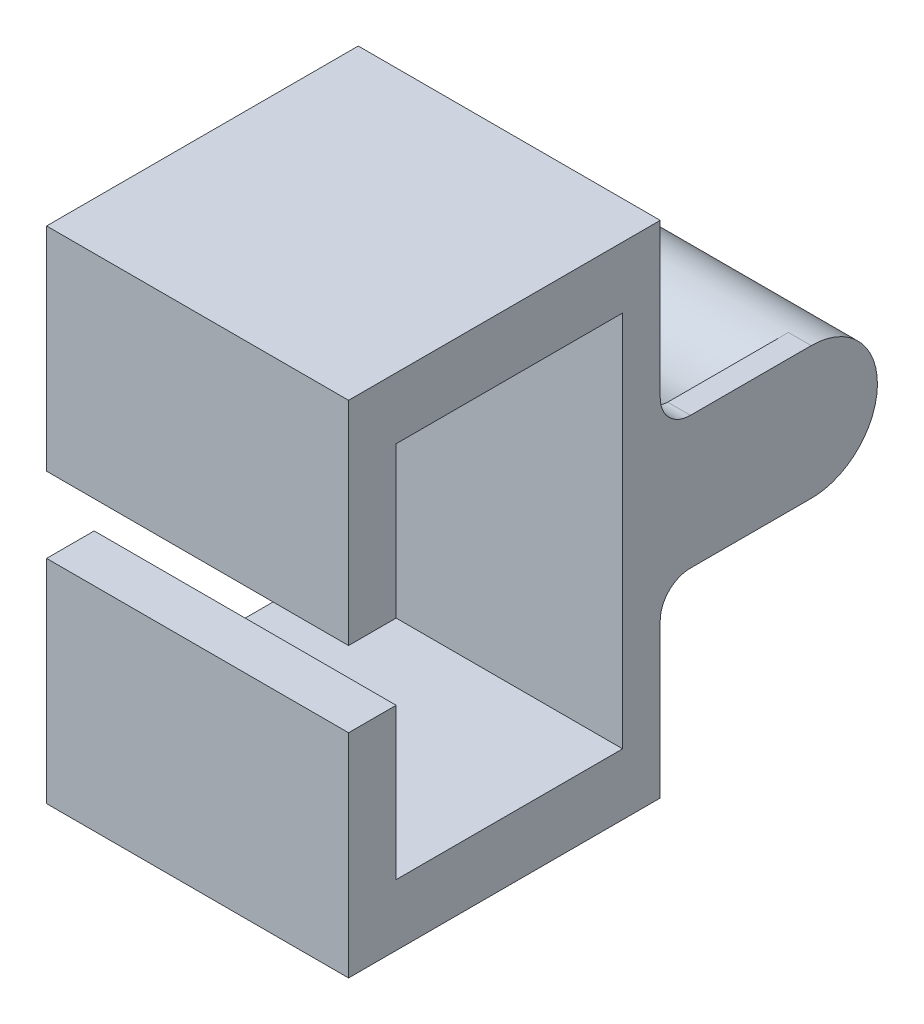
from build123d import *

# Parameters (mm, degrees)
SKETCH1_R           = 11.136121628
BOSS_EXTRUDE1_DEPTH = 50.8
SKETCH2_W           = 22.261321628
SKETCH2_H           = 25.4
BOSS_EXTRUDE2_DEPTH = 3.834635566
SKETCH3_W           = 63.5
SKETCH3_H           = 6.327245258
BOSS_EXTRUDE3_DEPTH = 50.8
SKETCH4_W           = 10.33234824
SKETCH4_H           = 44.427245258
BOSS_EXTRUDE4_DEPTH = 50.8
SKETCH5_W           = 35.73234824
SKETCH5_H           = 8.003402532
BOSS_EXTRUDE5_DEPTH = 50.8
SKETCH6_W           = 22.261321628
SKETCH6_H           = 25.4
BOSS_EXTRUDE6_DEPTH = 3.834635566
FILLET2_R           = 5.08


with BuildPart() as part:
    # Sketch1 → Boss-Extrude1 (new body)
    with BuildSketch(Plane.YZ):
        with Locations(Location((0, 0, 0), (0, 0, 270))):
            Circle(SKETCH1_R)
    extrude(amount=BOSS_EXTRUDE1_DEPTH)

    # Sketch2 → Boss-Extrude2 (add)
    with BuildSketch(Plane(origin=(0, 0, 0), x_dir=(0, -1, 0), z_dir=(-1, 0, 0))):
        with Locations((-0.005460814, 12.7)):
            Rectangle(SKETCH2_W, SKETCH2_H)
    extrude(amount=-BOSS_EXTRUDE2_DEPTH)

    # Sketch3 → Boss-Extrude3 (add)
    with BuildSketch(Plane.YZ):
        with Locations((0, 28.563622629)):
            Rectangle(SKETCH3_W, SKETCH3_H)
    extrude(amount=BOSS_EXTRUDE3_DEPTH)

    # Sketch4 → Boss-Extrude4 (add)
    with BuildSketch(Plane.YZ):
        with Locations((-36.91617412, 47.613622629)):
            Rectangle(SKETCH4_W, SKETCH4_H)
        with Locations((36.91617412, 47.613622629)):
            Rectangle(SKETCH4_W, SKETCH4_H)
    extrude(amount=BOSS_EXTRUDE4_DEPTH)

    # Sketch5 → Boss-Extrude5 (add)
    with BuildSketch(Plane.YZ):
        with Locations((-24.21617412, 73.828946524)):
            Rectangle(SKETCH5_W, SKETCH5_H)
        with Locations((24.21617412, 73.828946524)):
            Rectangle(SKETCH5_W, SKETCH5_H)
    extrude(amount=BOSS_EXTRUDE5_DEPTH)

    # Sketch6 → Boss-Extrude6 (add)
    with BuildSketch(Plane.YZ.offset(50.8)):
        with Locations((0.005460814, 12.7)):
            Rectangle(SKETCH6_W, SKETCH6_H)
    extrude(amount=-BOSS_EXTRUDE6_DEPTH)

    # Fillet2
    fillet2_edges = [part.edges().sort_by_distance(p)[0] for p in [
        (1.917317783, 11.136121628, 25.4),
        (3.834635566, 0.005460814, 25.4),
        (1.917317783, -11.1252, 25.4),
        (46.965364434, 0.005460814, 25.4),
        (48.882682217, -11.1252, 25.4),
        (48.882682217, 11.136121628, 25.4),
    ]]
    fillet(fillet2_edges, radius=FILLET2_R)


solid = part.part
